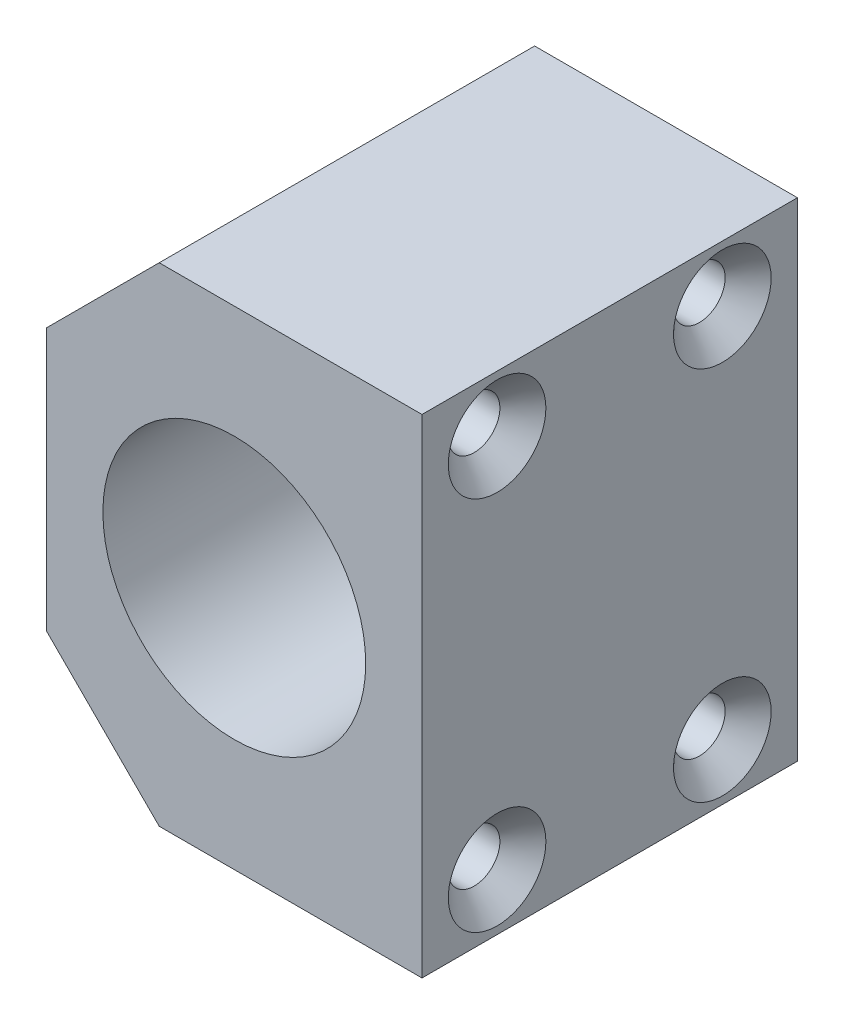
from build123d import *

# Parameters (mm, degrees)
BOSS_EXTRUDE1_DEPTH                                  = 40
SKETCH2_R                                            = 14
CUT_EXTRUDE1_DEPTH                                   = 40
CSK_FOR_M5_COUNTERSUNK_RAISED_HEAD_SCREW_D           = 5.5
CSK_FOR_M5_COUNTERSUNK_RAISED_HEAD_SCREW_DEPTH       = 12
CSK_FOR_M5_COUNTERSUNK_RAISED_HEAD_SCREW_CSINK_D     = 10.4
CSK_FOR_M5_COUNTERSUNK_RAISED_HEAD_SCREW_CSINK_ANGLE = 90
CSK_FOR_M5_COUNTERSUNK_RAISED_HEAD_SCREW_TIP         = 1.652366702


with BuildPart() as part:
    # Sketch1 → Boss-Extrude1 (new body)
    with BuildSketch(Plane.XY):
        Polygon((-20, -14), (-8, -26), (20, -26), (20, 26), (-8, 26), (-20, 14), align=None)
    extrude(amount=BOSS_EXTRUDE1_DEPTH)

    # Sketch2 → Cut-Extrude1 (cut)
    with BuildSketch(Plane.XY.offset(40)):
        Circle(SKETCH2_R)
    extrude(amount=-CUT_EXTRUDE1_DEPTH, mode=Mode.SUBTRACT)

    # CSK for M5 Countersunk Raised Head Screw1
    with Locations(Plane(origin=(20, 0, 0), x_dir=(0, 0, -1), z_dir=(1, 0, 0))):
        with Locations((-32, 20), (-8, 20), (-8, -20), (-32, -20)):
            CounterSinkHole(CSK_FOR_M5_COUNTERSUNK_RAISED_HEAD_SCREW_D / 2, CSK_FOR_M5_COUNTERSUNK_RAISED_HEAD_SCREW_CSINK_D / 2, depth=CSK_FOR_M5_COUNTERSUNK_RAISED_HEAD_SCREW_DEPTH, counter_sink_angle=CSK_FOR_M5_COUNTERSUNK_RAISED_HEAD_SCREW_CSINK_ANGLE)
            with Locations((0, 0, -(CSK_FOR_M5_COUNTERSUNK_RAISED_HEAD_SCREW_DEPTH + CSK_FOR_M5_COUNTERSUNK_RAISED_HEAD_SCREW_TIP / 2))):  # 118° drill point
                Cone(0, CSK_FOR_M5_COUNTERSUNK_RAISED_HEAD_SCREW_D / 2, CSK_FOR_M5_COUNTERSUNK_RAISED_HEAD_SCREW_TIP, mode=Mode.SUBTRACT)


solid = part.part
